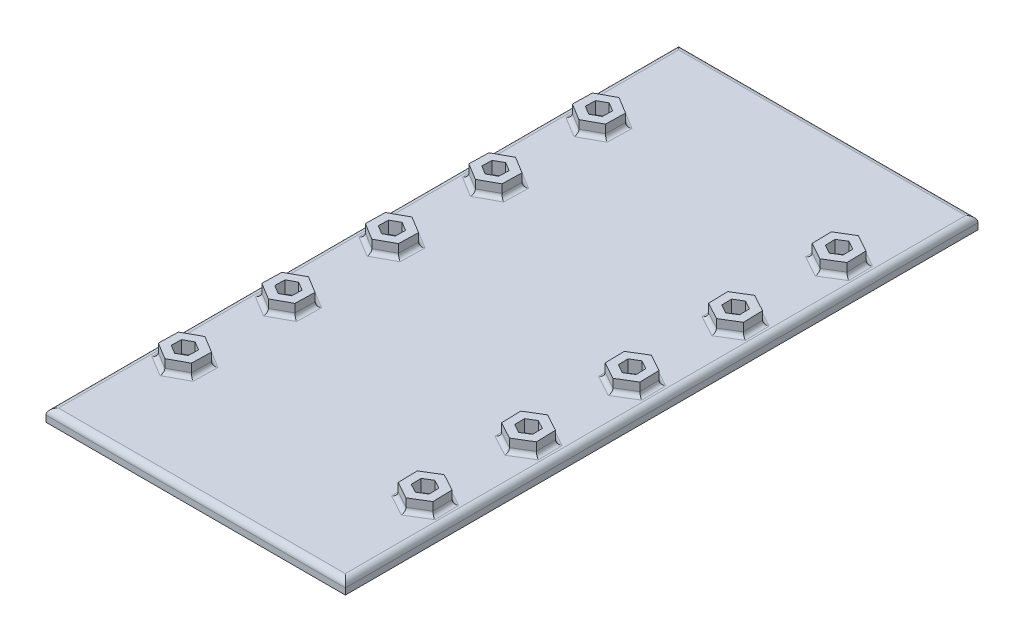
from build123d import *

# Parameters (mm, degrees)
SKETCH1_W            = 72.3
SKETCH1_H            = 152.8
BOSS_EXTRUDE1_DEPTH  = 3
CUT_EXTRUDE1_REACH   = 86.574
SKETCH2_R            = 1.2
BOSS_EXTRUDE2_DEPTH  = 3
FILLET1_R            = 1
FILLET1_OF_MIRROR2_R = 1
FILLET2_R            = 1.5


with BuildPart() as part:
    # Sketch1 → Boss-Extrude1 (new body)
    with BuildSketch(Plane(origin=(0, 0, 0), x_dir=(1, 0, 0), z_dir=(0, 1, 0))):
        Rectangle(SKETCH1_W, SKETCH1_H)
    extrude(amount=BOSS_EXTRUDE1_DEPTH)

    # Sketch2 → Cut-Extrude1 (cut, up to next)
    with BuildSketch(Plane(origin=(0, 3, 0), x_dir=(1, 0, 0), z_dir=(0, 1, 0)), mode=Mode.PRIVATE) as cut_extrude1_sk1:
        with Locations(Location((-29, -50, 0), (0, 0, 270))):
            Circle(SKETCH2_R)
    cut_extrude1_tool1 = extrude(cut_extrude1_sk1.sketch, amount=-CUT_EXTRUDE1_REACH, mode=Mode.PRIVATE) & part.part
    # Sketch2 → Cut-Extrude1 (cut, up to next)
    with BuildSketch(Plane(origin=(0, 3, 0), x_dir=(1, 0, 0), z_dir=(0, 1, 0)), mode=Mode.PRIVATE) as cut_extrude1_sk2:
        with Locations(Location((-29, -25, 0), (0, 0, 270))):
            Circle(SKETCH2_R)
    cut_extrude1_tool2 = extrude(cut_extrude1_sk2.sketch, amount=-CUT_EXTRUDE1_REACH, mode=Mode.PRIVATE) & part.part
    # Sketch2 → Cut-Extrude1 (cut, up to next)
    with BuildSketch(Plane(origin=(0, 3, 0), x_dir=(1, 0, 0), z_dir=(0, 1, 0)), mode=Mode.PRIVATE) as cut_extrude1_sk3:
        with Locations(Location((-29, 0, 0), (0, 0, 270))):
            Circle(SKETCH2_R)
    cut_extrude1_tool3 = extrude(cut_extrude1_sk3.sketch, amount=-CUT_EXTRUDE1_REACH, mode=Mode.PRIVATE) & part.part
    # Sketch2 → Cut-Extrude1 (cut, up to next)
    with BuildSketch(Plane(origin=(0, 3, 0), x_dir=(1, 0, 0), z_dir=(0, 1, 0)), mode=Mode.PRIVATE) as cut_extrude1_sk4:
        with Locations(Location((-29, 25, 0), (0, 0, 270))):
            Circle(SKETCH2_R)
    cut_extrude1_tool4 = extrude(cut_extrude1_sk4.sketch, amount=-CUT_EXTRUDE1_REACH, mode=Mode.PRIVATE) & part.part
    # Sketch2 → Cut-Extrude1 (cut, up to next)
    with BuildSketch(Plane(origin=(0, 3, 0), x_dir=(1, 0, 0), z_dir=(0, 1, 0)), mode=Mode.PRIVATE) as cut_extrude1_sk5:
        with Locations(Location((-29, 50, 0), (0, 0, 270))):
            Circle(SKETCH2_R)
    cut_extrude1_tool5 = extrude(cut_extrude1_sk5.sketch, amount=-CUT_EXTRUDE1_REACH, mode=Mode.PRIVATE) & part.part
    cut_extrude1_1 = cut_extrude1_tool1.solids().sort_by_distance((-29, 3, 50))[0]
    add(cut_extrude1_1, mode=Mode.SUBTRACT)
    cut_extrude1_2 = cut_extrude1_tool2.solids().sort_by_distance((-29, 3, 25))[0]
    add(cut_extrude1_2, mode=Mode.SUBTRACT)
    cut_extrude1_3 = cut_extrude1_tool3.solids().sort_by_distance((-29, 3, 0))[0]
    add(cut_extrude1_3, mode=Mode.SUBTRACT)
    cut_extrude1_4 = cut_extrude1_tool4.solids().sort_by_distance((-29, 3, -25))[0]
    add(cut_extrude1_4, mode=Mode.SUBTRACT)
    cut_extrude1_5 = cut_extrude1_tool5.solids().sort_by_distance((-29, 3, -50))[0]
    add(cut_extrude1_5, mode=Mode.SUBTRACT)
    cut_extrude1 = cut_extrude1_1 + cut_extrude1_2 + cut_extrude1_3 + cut_extrude1_4 + cut_extrude1_5  # Cut-Extrude1 as one shape, for the pattern or mirror that repeats it

    # Mirror1: Cut-Extrude1 across plane
    add(cut_extrude1.mirror(Plane(origin=(0, 0, 0), x_dir=(0, 0, 1), z_dir=(1, 0, 0))), mode=Mode.SUBTRACT)

    # Sketch5 → Boss-Extrude2 (add)
    # profile 1 of 5: a face of its own
    with BuildSketch(Plane(origin=(0, 3, 0), x_dir=(1, 0, 0), z_dir=(0, 1, 0))):
        Polygon((-33.041431524, -47.534201028), (-33.156160312, -52.267082882), (-29.114728788, -54.732881853), (-24.958568476, -52.465798972), (-24.843839688, -47.732917118), (-28.885271212, -45.267118147), align=None)
        Polygon((-29.058763525, -52.424158998), (-26.929998487, -51.262970205), (-26.871234962, -48.838811207), (-28.941236474, -47.575841002), (-31.070001512, -48.737029795), (-31.128765038, -51.161188793), align=None, mode=Mode.SUBTRACT)
    # profile 2 of 5: a face of its own
    with BuildSketch(Plane(origin=(0, 3, 0), x_dir=(1, 0, 0), z_dir=(0, 1, 0))):
        Polygon((-33.041431524, -22.534201028), (-33.156160312, -27.267082882), (-29.114728788, -29.732881853), (-24.958568476, -27.465798972), (-24.843839688, -22.732917118), (-28.885271212, -20.267118147), align=None)
        Polygon((-29.058763525, -27.424158998), (-26.929998487, -26.262970205), (-26.871234962, -23.838811207), (-28.941236474, -22.575841002), (-31.070001512, -23.737029795), (-31.128765038, -26.161188793), align=None, mode=Mode.SUBTRACT)
    # profile 3 of 5: a face of its own
    with BuildSketch(Plane(origin=(0, 3, 0), x_dir=(1, 0, 0), z_dir=(0, 1, 0))):
        Polygon((-33.041431524, 2.465798972), (-33.156160312, -2.267082882), (-29.114728788, -4.732881853), (-24.958568476, -2.465798972), (-24.843839688, 2.267082882), (-28.885271212, 4.732881853), align=None)
        Polygon((-31.128765038, -1.161188793), (-29.058763525, -2.424158998), (-26.929998487, -1.262970205), (-26.871234962, 1.161188793), (-28.941236474, 2.424158998), (-31.070001512, 1.262970205), align=None, mode=Mode.SUBTRACT)
    # profile 4 of 5: a face of its own
    with BuildSketch(Plane(origin=(0, 3, 0), x_dir=(1, 0, 0), z_dir=(0, 1, 0))):
        Polygon((-33.041431524, 27.465798972), (-33.156160312, 22.732917118), (-29.114728788, 20.267118147), (-24.958568476, 22.534201028), (-24.843839688, 27.267082882), (-28.885271212, 29.732881853), align=None)
        Polygon((-29.058763525, 22.575841002), (-26.929998487, 23.737029795), (-26.871234962, 26.161188793), (-28.941236474, 27.424158998), (-31.070001512, 26.262970205), (-31.128765038, 23.838811207), align=None, mode=Mode.SUBTRACT)
    # profile 5 of 5: a face of its own
    with BuildSketch(Plane(origin=(0, 3, 0), x_dir=(1, 0, 0), z_dir=(0, 1, 0))):
        Polygon((-33.041431524, 52.465798972), (-33.156160312, 47.732917118), (-29.114728788, 45.267118147), (-24.958568476, 47.534201028), (-24.843839688, 52.267082882), (-28.885271212, 54.732881853), align=None)
        Polygon((-29.058763525, 47.575841002), (-26.929998487, 48.737029795), (-26.871234962, 51.161188793), (-28.941236474, 52.424158998), (-31.070001512, 51.262970205), (-31.128765038, 48.838811207), align=None, mode=Mode.SUBTRACT)
    boss_extrude2 = extrude(amount=BOSS_EXTRUDE2_DEPTH)

    # Fillet1
    fillet1_edges = [part.edges().sort_by_distance(p)[0] for p in [
        (-33.098795918, 3, 24.900641955),
        (-31.13544455, 3, 28.499982368),
        (-27.036648632, 3, 28.599340413),
        (-24.901204082, 3, 25.099358045),
        (-26.86455545, 3, 21.500017632),
        (-30.963351368, 3, 21.400659587),
        (-33.098795918, 3, -0.099358045),
        (-31.13544455, 3, 3.499982368),
        (-27.036648632, 3, 3.599340413),
        (-24.901204082, 3, 0.099358045),
        (-26.86455545, 3, -3.499982368),
        (-30.963351368, 3, -3.599340413),
        (-33.098795918, 3, -25.099358045),
        (-31.13544455, 3, -21.500017632),
        (-27.036648632, 3, -21.400659587),
        (-24.901204082, 3, -24.900641955),
        (-26.86455545, 3, -28.499982368),
        (-30.963351368, 3, -28.599340413),
        (-33.098795918, 3, -50.099358045),
        (-31.13544455, 3, -46.500017632),
        (-27.036648632, 3, -46.400659587),
        (-24.901204082, 3, -49.900641955),
        (-26.86455545, 3, -53.499982368),
        (-30.963351368, 3, -53.599340413),
        (-33.098795918, 3, 49.900641955),
        (-31.13544455, 3, 53.499982368),
        (-27.036648632, 3, 53.599340413),
        (-24.901204082, 3, 50.099358045),
        (-26.86455545, 3, 46.500017632),
        (-30.963351368, 3, 46.400659587),
    ]]
    fillet(fillet1_edges, radius=FILLET1_R)

    # Mirror2: Boss-Extrude2 across plane
    add(boss_extrude2.mirror(Plane(origin=(0, 0, 0), x_dir=(0, 0, 1), z_dir=(1, 0, 0))))

    # Fillet1 of Mirror2
    fillet1_of_mirror2_edges = [part.edges().sort_by_distance(p)[0] for p in [
        (33.098795918, 3, 24.900641955),
        (31.13544455, 3, 28.499982368),
        (27.036648632, 3, 28.599340413),
        (24.901204082, 3, 25.099358045),
        (26.86455545, 3, 21.500017632),
        (30.963351368, 3, 21.400659587),
        (33.098795918, 3, -0.099358045),
        (31.13544455, 3, 3.499982368),
        (27.036648632, 3, 3.599340413),
        (24.901204082, 3, 0.099358045),
        (26.86455545, 3, -3.499982368),
        (30.963351368, 3, -3.599340413),
        (33.098795918, 3, -25.099358045),
        (31.13544455, 3, -21.500017632),
        (27.036648632, 3, -21.400659587),
        (24.901204082, 3, -24.900641955),
        (26.86455545, 3, -28.499982368),
        (30.963351368, 3, -28.599340413),
        (33.098795918, 3, -50.099358045),
        (31.13544455, 3, -46.500017632),
        (27.036648632, 3, -46.400659587),
        (24.901204082, 3, -49.900641955),
        (26.86455545, 3, -53.499982368),
        (30.963351368, 3, -53.599340413),
        (33.098795918, 3, 49.900641955),
        (31.13544455, 3, 53.499982368),
        (27.036648632, 3, 53.599340413),
        (24.901204082, 3, 50.099358045),
        (26.86455545, 3, 46.500017632),
        (30.963351368, 3, 46.400659587),
    ]]
    fillet(fillet1_of_mirror2_edges, radius=FILLET1_OF_MIRROR2_R)

    # Fillet2
    fillet2_edges = [part.edges().sort_by_distance(p)[0] for p in [
        (-36.15, 3, 0),
        (0, 3, 76.4),
        (36.15, 3, 0),
        (0, 3, -76.4),
    ]]
    fillet(fillet2_edges, radius=FILLET2_R)


solid = part.part
